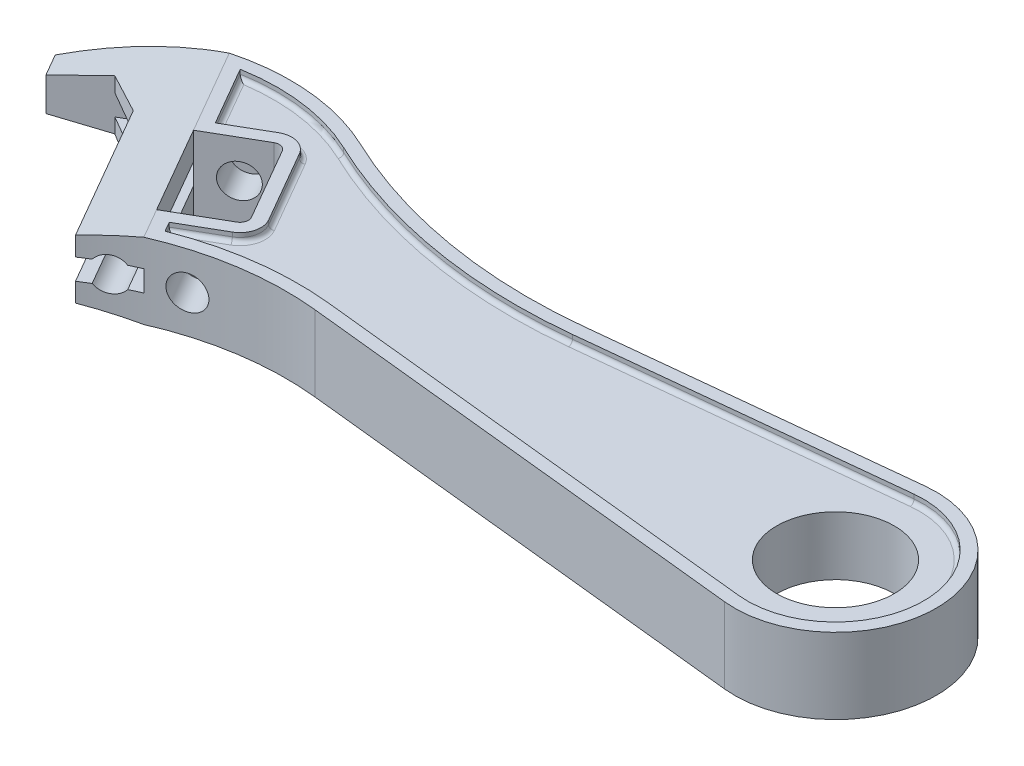
from build123d import *

# Parameters (mm, degrees)
SKETCH1_R                           = 7
BOSS_EXTRUDE1_DEPTH                 = 4.5
SKETCH2_R                           = 2
CUT_EXTRUDE1_DEPTH                  = 4
CUT_EXTRUDE1_DIRECTION_2_REACH      = 94.877
CUT_EXTRUDE1_DIRECTION_2_END_RADIUS = 35
CUT_EXTRUDE2_REACH                  = 95.696
CUT_EXTRUDE3_DEPTH                  = 94.695806816
CUT_EXTRUDE3_DEPTH_BACK             = 94.695806816
FILLET1_R                           = 1
CUT_EXTRUDE4_DEPTH                  = 1
FILLET2_R                           = 0.5
FILLET2_OF_MIRROR1_R                = 0.5


with BuildPart() as part:
    # Sketch1 → Boss-Extrude1 (new, symmetric)
    # profile 1 of 2: a face of its own
    with BuildSketch(Plane(origin=(0, 0, 0), x_dir=(1, 0, 0), z_dir=(0, 1, 0))):
        with BuildLine():
            Line((-1.254341559, 11.934262744), (-38.050135484, 8.066868963))
            ThreePointArc((-38.050135484, 8.066868963), (-54.467911448, 8.602260432), (-70.125211386, 13.570053731))
            ThreePointArc((-70.125211386, 13.570053731), (-78.585282956, 15.894774523), (-87.327562788, 15.153369736))
            Line((-87.327562788, 15.153369736), (-81.509618943, 5.076395401))
            Line((-81.509618943, 5.076395401), (-74.581415713, 9.076395401))
            Line((-74.581415713, 9.076395401), (-68.581415713, -1.315909444))
            Line((-68.581415713, -1.315909444), (-75.509618943, -5.315909444))
            Line((-75.509618943, -5.315909444), (-73.428468454, -8.92056783))
            ThreePointArc((-73.428468454, -8.92056783), (-64.788404808, -6.418782239), (-55.79604663, -6.201698543))
            Line((-55.79604663, -6.201698543), (-1.254341559, -11.934262744))
            ThreePointArc((-1.254341559, -11.934262744), (12, 0), (-1.254341559, 11.934262744))
        make_face()
        with Locations(Location((0, 0, 0), (0, 0, 270))):
            Circle(SKETCH1_R, mode=Mode.SUBTRACT)
    # profile 2 of 2: a face of its own
    with BuildSketch(Plane(origin=(0, 0, 0), x_dir=(1, 0, 0), z_dir=(0, 1, 0))):
        with BuildLine():
            Line((-81.509618943, 5.076395401), (-87.327562788, 15.153369736))
            ThreePointArc((-87.327562788, 15.153369736), (-94.282399056, 12.101775932), (-100, 7.102674843))
            Line((-100, 7.102674843), (-98.5, 4.504598631))
            Line((-98.5, 4.504598631), (-93.303847577, 7.504598631))
            Line((-93.303847577, 7.504598631), (-88.107695155, 4.504598631))
            Line((-88.107695155, 4.504598631), (-78.705771366, -11.78001106))
            ThreePointArc((-78.705771366, -11.78001106), (-76.12852919, -10.236954314), (-73.428468454, -8.92056783))
            Line((-73.428468454, -8.92056783), (-75.509618943, -5.315909444))
            Line((-75.509618943, -5.315909444), (-81.509618943, 5.076395401))
        make_face()
    extrude(amount=BOSS_EXTRUDE1_DEPTH, both=True)

    # Sketch2 → Cut-Extrude1 (cut)
    with BuildSketch(Plane(origin=(-22.575548424, 0, -39.10199688), x_dir=(0.8660254037844372, 0, -0.5000000000000027), z_dir=(0.5000000000000027, 0, 0.8660254037844372))):
        with Locations(Location((-64.051202957, 0, 0), (0, 0, 180))):
            Circle(SKETCH2_R)
    extrude(amount=-CUT_EXTRUDE1_DEPTH, mode=Mode.SUBTRACT)

    # Cut-Extrude1 direction 2: up to this cylinder (the profile starts outside it)
    cut_extrude1_direction_2_end = Plane(origin=(-59.454542844, 0, 41.009964881), z_dir=(0, -1, 0)) * Cylinder(CUT_EXTRUDE1_DIRECTION_2_END_RADIUS, 260.754, mode=Mode.PRIVATE)
    # Sketch2 → Cut-Extrude1 direction 2 (cut, up to the surface)
    with BuildSketch(Plane(origin=(-22.575548424, 0, -39.10199688), x_dir=(0.8660254037844372, 0, -0.5000000000000027), z_dir=(0.5000000000000027, 0, 0.8660254037844372)), mode=Mode.PRIVATE) as cut_extrude1_direction_2_sk1:
        with Locations(Location((-64.051202957, 0, 0), (0, 0, 180))):
            Circle(SKETCH2_R)
    cut_extrude1_direction_2_tool1 = extrude(cut_extrude1_direction_2_sk1.sketch, amount=CUT_EXTRUDE1_DIRECTION_2_REACH, mode=Mode.PRIVATE) - cut_extrude1_direction_2_end
    add(cut_extrude1_direction_2_tool1.solids().sort_by_distance((-78.045517, 0, -7.076395))[0], mode=Mode.SUBTRACT)

    # Sketch3 → Cut-Extrude2 (cut, up to next)
    with BuildSketch(Plane(origin=(-26.575548424, 0, -46.03020011), x_dir=(0.8660254037844374, 0, -0.5000000000000023), z_dir=(0.5000000000000023, 0, 0.8660254037844374)), mode=Mode.PRIVATE) as cut_extrude2_sk1:
        with BuildLine():
            ThreePointArc((-72.612452457, 1.25), (-72.938330271, 0.662382443), (-73.051202957, 0))
            Line((-73.051202957, 0), (-69.051202957, 0))
            ThreePointArc((-69.051202957, 0), (-69.164075643, 0.662382443), (-69.489953458, 1.25))
            ThreePointArc((-69.489953458, 1.25), (-71.051202957, 2), (-72.612452457, 1.25))
        make_face()
    cut_extrude2_tool1 = extrude(cut_extrude2_sk1.sketch, amount=CUT_EXTRUDE2_REACH, mode=Mode.PRIVATE) & part.part
    # Sketch3 → Cut-Extrude2 (cut, up to next)
    with BuildSketch(Plane(origin=(-26.575548424, 0, -46.03020011), x_dir=(0.8660254037844374, 0, -0.5000000000000023), z_dir=(0.5000000000000023, 0, 0.8660254037844374)), mode=Mode.PRIVATE) as cut_extrude2_sk2:
        with BuildLine():
            Line((-69.051202957, 0), (-73.051202957, 0))
            ThreePointArc((-73.051202957, 0), (-72.938330271, -0.662382443), (-72.612452457, -1.25))
            ThreePointArc((-72.612452457, -1.25), (-71.051202957, -2), (-69.489953458, -1.25))
            ThreePointArc((-69.489953458, -1.25), (-69.164075643, -0.662382443), (-69.051202957, 0))
        make_face()
    cut_extrude2_tool2 = extrude(cut_extrude2_sk2.sketch, amount=CUT_EXTRUDE2_REACH, mode=Mode.PRIVATE) & part.part
    # Sketch3 → Cut-Extrude2 (cut, up to next)
    with BuildSketch(Plane(origin=(-26.575548424, 0, -46.03020011), x_dir=(0.8660254037844374, 0, -0.5000000000000023), z_dir=(0.5000000000000023, 0, 0.8660254037844374)), mode=Mode.PRIVATE) as cut_extrude2_sk3:
        with BuildLine():
            ThreePointArc((-72.612452457, 1.25), (-72.938330271, 0.662382443), (-73.051202957, 0))
            Line((-73.051202957, 0), (-69.051202957, 0))
            ThreePointArc((-69.051202957, 0), (-69.164075643, 0.662382443), (-69.489953458, 1.25))
            ThreePointArc((-69.489953458, 1.25), (-71.051202957, 2), (-72.612452457, 1.25))
        make_face()
    cut_extrude2_tool3 = extrude(cut_extrude2_sk3.sketch, amount=CUT_EXTRUDE2_REACH, mode=Mode.PRIVATE) & part.part
    # Sketch3 → Cut-Extrude2 (cut, up to next)
    with BuildSketch(Plane(origin=(-26.575548424, 0, -46.03020011), x_dir=(0.8660254037844374, 0, -0.5000000000000023), z_dir=(0.5000000000000023, 0, 0.8660254037844374)), mode=Mode.PRIVATE) as cut_extrude2_sk4:
        with BuildLine():
            Line((-69.051202957, 0), (-73.051202957, 0))
            ThreePointArc((-73.051202957, 0), (-72.938330271, -0.662382443), (-72.612452457, -1.25))
            ThreePointArc((-72.612452457, -1.25), (-71.051202957, -2), (-69.489953458, -1.25))
            ThreePointArc((-69.489953458, -1.25), (-69.164075643, -0.662382443), (-69.051202957, 0))
        make_face()
    cut_extrude2_tool4 = extrude(cut_extrude2_sk4.sketch, amount=CUT_EXTRUDE2_REACH, mode=Mode.PRIVATE) & part.part
    # Sketch3 → Cut-Extrude2 (cut, up to next)
    with BuildSketch(Plane(origin=(-26.575548424, 0, -46.03020011), x_dir=(0.8660254037844374, 0, -0.5000000000000023), z_dir=(0.5000000000000023, 0, 0.8660254037844374)), mode=Mode.PRIVATE) as cut_extrude2_sk5:
        with BuildLine():
            Line((-77.051202957, 1.25), (-77.051202957, 0))
            Line((-77.051202957, 0), (-73.051202957, 0))
            ThreePointArc((-73.051202957, 0), (-72.938330271, 0.662382443), (-72.612452457, 1.25))
            Line((-72.612452457, 1.25), (-77.051202957, 1.25))
        make_face()
    cut_extrude2_tool5 = extrude(cut_extrude2_sk5.sketch, amount=CUT_EXTRUDE2_REACH, mode=Mode.PRIVATE) & part.part
    # Sketch3 → Cut-Extrude2 (cut, up to next)
    with BuildSketch(Plane(origin=(-26.575548424, 0, -46.03020011), x_dir=(0.8660254037844374, 0, -0.5000000000000023), z_dir=(0.5000000000000023, 0, 0.8660254037844374)), mode=Mode.PRIVATE) as cut_extrude2_sk6:
        with BuildLine():
            Line((-73.051202957, 0), (-77.051202957, 0))
            Line((-77.051202957, 0), (-77.051202957, -1.25))
            Line((-77.051202957, -1.25), (-72.612452457, -1.25))
            ThreePointArc((-72.612452457, -1.25), (-72.938330271, -0.662382443), (-73.051202957, 0))
        make_face()
    cut_extrude2_tool6 = extrude(cut_extrude2_sk6.sketch, amount=CUT_EXTRUDE2_REACH, mode=Mode.PRIVATE) & part.part
    # Sketch3 → Cut-Extrude2 (cut, up to next)
    with BuildSketch(Plane(origin=(-26.575548424, 0, -46.03020011), x_dir=(0.8660254037844374, 0, -0.5000000000000023), z_dir=(0.5000000000000023, 0, 0.8660254037844374)), mode=Mode.PRIVATE) as cut_extrude2_sk7:
        with BuildLine():
            ThreePointArc((-69.489953458, 1.25), (-69.164075643, 0.662382443), (-69.051202957, 0))
            Line((-69.051202957, 0), (-68.051202957, 0))
            Line((-68.051202957, 0), (-68.051202957, 1.25))
            Line((-68.051202957, 1.25), (-69.489953458, 1.25))
        make_face()
    cut_extrude2_tool7 = extrude(cut_extrude2_sk7.sketch, amount=CUT_EXTRUDE2_REACH, mode=Mode.PRIVATE) & part.part
    # Sketch3 → Cut-Extrude2 (cut, up to next)
    with BuildSketch(Plane(origin=(-26.575548424, 0, -46.03020011), x_dir=(0.8660254037844374, 0, -0.5000000000000023), z_dir=(0.5000000000000023, 0, 0.8660254037844374)), mode=Mode.PRIVATE) as cut_extrude2_sk8:
        with BuildLine():
            Line((-68.051202957, 0), (-69.051202957, 0))
            ThreePointArc((-69.051202957, 0), (-69.164075643, -0.662382443), (-69.489953458, -1.25))
            Line((-69.489953458, -1.25), (-68.051202957, -1.25))
            Line((-68.051202957, -1.25), (-68.051202957, 0))
        make_face()
    cut_extrude2_tool8 = extrude(cut_extrude2_sk8.sketch, amount=CUT_EXTRUDE2_REACH, mode=Mode.PRIVATE) & part.part
    add(cut_extrude2_tool1.solids().sort_by_distance((-88.107695, 0.848826, -10.504599))[0], mode=Mode.SUBTRACT)
    add(cut_extrude2_tool2.solids().sort_by_distance((-88.107695, -0.848826, -10.504599))[0], mode=Mode.SUBTRACT)
    add(cut_extrude2_tool3.solids().sort_by_distance((-88.107695, 0.848826, -10.504599))[0], mode=Mode.SUBTRACT)
    add(cut_extrude2_tool4.solids().sort_by_distance((-88.107695, -0.848826, -10.504599))[0], mode=Mode.SUBTRACT)
    add(cut_extrude2_tool5.solids().sort_by_distance((-91.509815, 0.635751, -8.540384))[0], mode=Mode.SUBTRACT)
    add(cut_extrude2_tool6.solids().sort_by_distance((-91.509815, -0.635751, -8.540384))[0], mode=Mode.SUBTRACT)
    add(cut_extrude2_tool7.solids().sort_by_distance((-86.009148, 0.664064, -11.716195))[0], mode=Mode.SUBTRACT)
    add(cut_extrude2_tool8.solids().sort_by_distance((-86.009148, -0.664064, -11.716195))[0], mode=Mode.SUBTRACT)

    # Sketch4 → Cut-Extrude3 (cut, two sides: drawn at the far end of the back side and taken through both)
    with BuildSketch(Plane(origin=(-26.575548424, 0, -46.03020011), x_dir=(0.8660254037844374, 0, -0.5000000000000023), z_dir=(0.5000000000000023, 0, 0.8660254037844374)).offset(-CUT_EXTRUDE3_DEPTH_BACK)):
        Polygon((-68.051202957, 4.5), (-83.051202957, 4.5), (-83.051202957, 2), align=None)
        Polygon((-68.051202957, -4.5), (-83.051202957, -4.5), (-83.051202957, -2), align=None)
    extrude(amount=CUT_EXTRUDE3_DEPTH + CUT_EXTRUDE3_DEPTH_BACK, mode=Mode.SUBTRACT)

    # Fillet1
    fillet1_edges = [part.edges().sort_by_distance(p)[0] for p in [
        (-68.581415713, 0, 1.315909444),
        (-74.581415713, 0, -9.076395401),
    ]]
    fillet(fillet1_edges, radius=FILLET1_R)

    # Sketch5 → Cut-Extrude4 (cut)
    with BuildSketch(Plane(origin=(0, 4.5, 0), x_dir=(1, 0, 0), z_dir=(0, 1, 0))):
        with BuildLine():
            Line((-85.007070656, 14.134159464), (-80.960580838, 7.125433507))
            Line((-80.960580838, 7.125433507), (-76.197441117, 9.875433507))
            ThreePointArc((-76.197441117, 9.875433507), (-74.300393504, 10.125184563), (-72.782377607, 8.960369997))
            Line((-72.782377607, 8.960369997), (-67.782377607, 0.300115959))
            ThreePointArc((-67.782377607, 0.300115959), (-67.532626551, -1.596931653), (-68.697441117, -3.11494755))
            Line((-68.697441117, -3.11494755), (-73.460580838, -5.86494755))
            Line((-73.460580838, -5.86494755), (-72.786777808, -7.032008632))
            ThreePointArc((-72.786777808, -7.032008632), (-64.352613326, -4.84010304), (-55.639253935, -4.7099157))
            Line((-55.639253935, -4.7099157), (-1.097548864, -10.442479901))
            ThreePointArc((-1.097548864, -10.442479901), (10.5, 0), (-1.097548864, 10.442479901))
            Line((-1.097548864, 10.442479901), (-37.893342789, 6.57508612))
            ThreePointArc((-37.893342789, 6.57508612), (-54.721563152, 7.123862376), (-70.770295589, 12.215850507))
            ThreePointArc((-70.770295589, 12.215850507), (-77.738508199, 14.289531708), (-85.007070656, 14.134159464))
        make_face()
    cut_extrude4 = extrude(amount=-CUT_EXTRUDE4_DEPTH, mode=Mode.SUBTRACT)

    # Fillet2
    fillet2_edges = [part.edges().sort_by_distance(p)[0] for p in [
        (-54.721563152, 3.5, -7.123862376),
        (-19.495445827, 3.5, -8.508783011),
        (10.5, 3.5, 0),
        (-28.3684014, 3.5, 7.576197801),
        (-64.352613326, 3.5, 4.84010304),
        (-73.123679323, 3.5, 6.448478091),
        (-71.079010977, 3.5, 4.48994755),
        (-67.532626551, 3.5, 1.596931653),
        (-70.282377607, 3.5, -4.630242978),
        (-74.300393504, 3.5, -10.125184563),
        (-78.579010977, 3.5, -8.500433507),
        (-82.983825747, 3.5, -10.629796486),
        (-77.738508199, 3.5, -14.289531708),
    ]]
    fillet(fillet2_edges, radius=FILLET2_R)

    # Mirror1: Cut-Extrude4 across plane
    add(cut_extrude4.mirror(Plane.ZX), mode=Mode.SUBTRACT)

    # Fillet2 of Mirror1
    fillet2_of_mirror1_edges = [part.edges().sort_by_distance(p)[0] for p in [
        (-54.721563152, -3.5, -7.123862376),
        (-19.495445827, -3.5, -8.508783011),
        (10.5, -3.5, 0),
        (-28.3684014, -3.5, 7.576197801),
        (-64.352613326, -3.5, 4.84010304),
        (-73.123679323, -3.5, 6.448478091),
        (-71.079010977, -3.5, 4.48994755),
        (-67.532626551, -3.5, 1.596931653),
        (-70.282377607, -3.5, -4.630242978),
        (-74.300393504, -3.5, -10.125184563),
        (-78.579010977, -3.5, -8.500433507),
        (-82.983825747, -3.5, -10.629796486),
        (-77.738508199, -3.5, -14.289531708),
    ]]
    fillet(fillet2_of_mirror1_edges, radius=FILLET2_OF_MIRROR1_R)


solid = part.part
